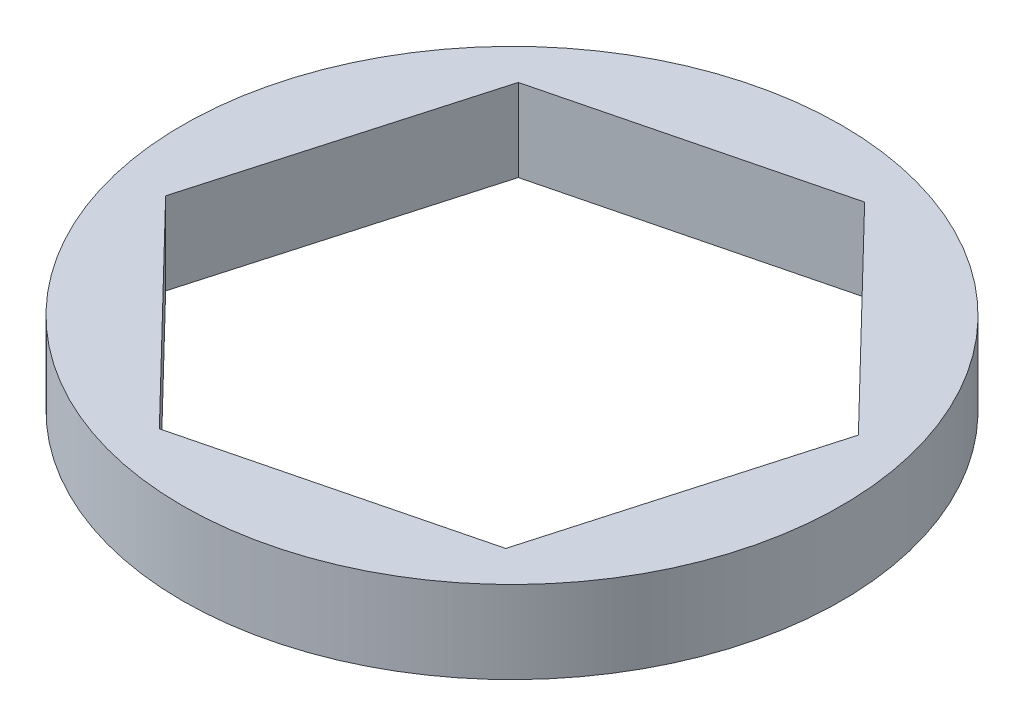
from build123d import *

# Parameters (mm, degrees)
SKETCH1_R           = 6.35
BOSS_EXTRUDE1_DEPTH = 1.5875


with BuildPart() as part:
    # Sketch1 → Boss-Extrude1 (new body)
    with BuildSketch(Plane(origin=(0, 0, 0), x_dir=(1, 0, 0), z_dir=(0, 1, 0))):
        with Locations(Location((0, 0, 0), (0, 0, 270))):
            Circle(SKETCH1_R)
        Polygon((1.505663563, 5.289125848), (-3.827685567, 3.948505819), (-5.333349129, -1.340620029), (-1.505663563, -5.289125848), (3.827685567, -3.948505819), (5.333349129, 1.340620029), align=None, mode=Mode.SUBTRACT)
    extrude(amount=BOSS_EXTRUDE1_DEPTH)


solid = part.part
